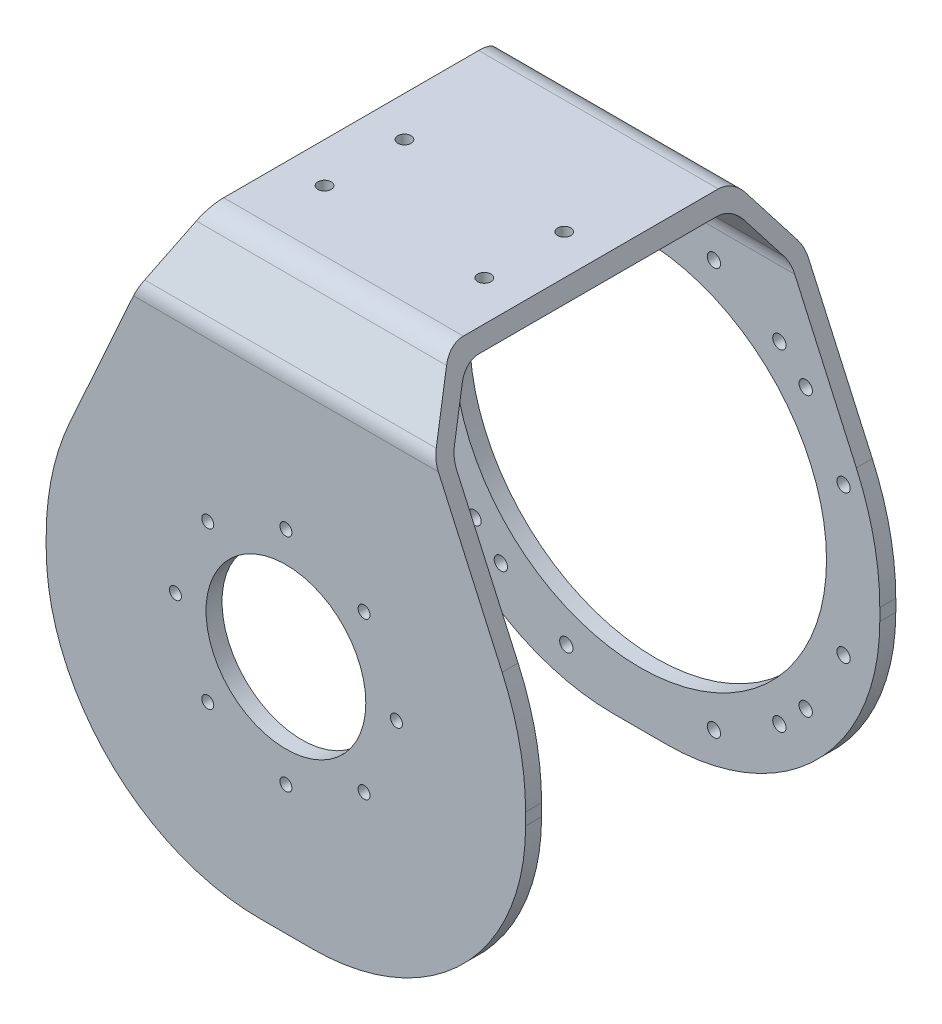
from build123d import *

# Parameters (mm, degrees)
EXTRUDE_1_DEPTH          = 180
CUT_EXTRUDE_1_DEPTH      = 283.252103624
CUT_EXTRUDE_1_DEPTH_BACK = 283.252103624
SKETCH_13_R              = 70
SKETCH_13_R_2            = 2.5
CUT_EXTRUDE_2_DEPTH      = 50
SKETCH_14_R              = 2.5
CUT_EXTRUDE_3_DEPTH      = 6
SKETCH_15_R              = 30
SKETCH_15_R_2            = 2.25
CUT_EXTRUDE_4_DEPTH      = 6
FILLET_1_R               = 100
FILLET_2_R               = 80
FILLET_3_R               = 10


with BuildPart() as part:
    # 草图11 → 拉伸-薄壁1 (new body)
    with BuildSketch(Plane(origin=(0, 0, 0), x_dir=(0, 0, -1), z_dir=(1, 0, 0))):
        Polygon((-63.5, 0), (-63.5, 180), (-50, 200), (50, 200), (63.5, 180), (63.5, 0), (69.5, 0), (69.5, 181.835492011), (53.188957107, 206), (-53.188957107, 206), (-69.5, 181.835492011), (-69.5, 0), align=None)
    extrude(amount=EXTRUDE_1_DEPTH)

    # 草图12 → 切除-拉伸1 (cut, two sides: drawn at the far end of the back side and taken through both)
    with BuildSketch(Plane.XY.offset(-CUT_EXTRUDE_1_DEPTH_BACK)):
        Polygon((45, 206), (0, 106), (0, 206), align=None)
        Polygon((180, 106), (180, 206), (135, 206), align=None)
    extrude(amount=CUT_EXTRUDE_1_DEPTH + CUT_EXTRUDE_1_DEPTH_BACK, mode=Mode.SUBTRACT)

    # 草图13 → 切除-拉伸2 (cut)
    with BuildSketch(Plane(origin=(0, 0, -69.5), x_dir=(-1, 0, 0), z_dir=(0, 0, -1))):
        with Locations(Location((-90, 90, 0), (0, 0, 90))):
            Circle(SKETCH_13_R)
        with Locations(Location((-117.709167863, 166.379084286, 0), (0, 0, 90))):
            Circle(SKETCH_13_R_2)
        with Locations(Location((-142.291643378, 152.18638543, 0), (0, 0, 90))):
            Circle(SKETCH_13_R_2)
        with Locations(Location((-152.18638543, 142.291643378, 0), (0, 0, 90))):
            Circle(SKETCH_13_R_2)
        with Locations(Location((-166.379084286, 117.709167863, 0), (0, 0, 90))):
            Circle(SKETCH_13_R_2)
        with Locations(Location((-13.620915714, 117.709167863, 0), (0, 0, 90))):
            Circle(SKETCH_13_R_2)
        with Locations(Location((-27.81361457, 142.291643378, 0), (0, 0, 90))):
            Circle(SKETCH_13_R_2)
        with Locations(Location((-37.708356622, 152.18638543, 0), (0, 0, 90))):
            Circle(SKETCH_13_R_2)
        with Locations(Location((-62.290832137, 166.379084286, 0), (0, 0, 90))):
            Circle(SKETCH_13_R_2)
        with Locations(Location((-62.290832137, 13.620915714, 0), (0, 0, 90))):
            Circle(SKETCH_13_R_2)
        with Locations(Location((-37.708356622, 27.81361457, 0), (0, 0, 90))):
            Circle(SKETCH_13_R_2)
        with Locations(Location((-27.81361457, 37.708356622, 0), (0, 0, 90))):
            Circle(SKETCH_13_R_2)
        with Locations(Location((-13.620915714, 62.290832137, 0), (0, 0, 90))):
            Circle(SKETCH_13_R_2)
        with Locations(Location((-166.379084286, 62.290832137, 0), (0, 0, 90))):
            Circle(SKETCH_13_R_2)
        with Locations(Location((-152.18638543, 37.708356622, 0), (0, 0, 90))):
            Circle(SKETCH_13_R_2)
        with Locations(Location((-142.291643378, 27.81361457, 0), (0, 0, 90))):
            Circle(SKETCH_13_R_2)
        with Locations(Location((-117.709167863, 13.620915714, 0), (0, 0, 90))):
            Circle(SKETCH_13_R_2)
    extrude(amount=-CUT_EXTRUDE_2_DEPTH, mode=Mode.SUBTRACT)

    # 草图14 → 切除-拉伸3 (cut)
    with BuildSketch(Plane(origin=(0, 206, 0), x_dir=(1, 0, 0), z_dir=(0, 1, 0))):
        with Locations(Location((120, 5, 0), (0, 0, 270))):
            Circle(SKETCH_14_R)
        with Locations(Location((120, -25, 0), (0, 0, 90))):
            Circle(SKETCH_14_R)
        with Locations(Location((60, -25, 0), (0, 0, 270))):
            Circle(SKETCH_14_R)
        with Locations(Location((60, 5, 0), (0, 0, 90))):
            Circle(SKETCH_14_R)
    extrude(amount=-CUT_EXTRUDE_3_DEPTH, mode=Mode.SUBTRACT)

    # 草图15 → 切除-拉伸4 (cut)
    with BuildSketch(Plane.XY.offset(69.5)):
        with Locations((90, 90)):
            Circle(SKETCH_15_R)
        with Locations((90, 131.5)):
            Circle(SKETCH_15_R_2)
        with Locations((119.344931419, 119.344931419)):
            Circle(SKETCH_15_R_2)
        with Locations((131.5, 90)):
            Circle(SKETCH_15_R_2)
        with Locations((119.344931419, 60.655068581)):
            Circle(SKETCH_15_R_2)
        with Locations((90, 48.5)):
            Circle(SKETCH_15_R_2)
        with Locations((60.655068581, 60.655068581)):
            Circle(SKETCH_15_R_2)
        with Locations((48.5, 90)):
            Circle(SKETCH_15_R_2)
        with Locations((60.655068581, 119.344931419)):
            Circle(SKETCH_15_R_2)
    extrude(amount=-CUT_EXTRUDE_4_DEPTH, mode=Mode.SUBTRACT)

    # 圆角1
    fillet_1_edges = [part.edges().sort_by_distance(p)[0] for p in [
        (0, 106, 66.5),
        (180, 106, 66.5),
        (0, 106, -66.5),
        (180, 106, -66.5),
    ]]
    fillet(fillet_1_edges, radius=FILLET_1_R)

    # 圆角2
    fillet_2_edges = [part.edges().sort_by_distance(p)[0] for p in [
        (0, 0, -66.5),
        (0, 0, 66.5),
        (180, 0, -66.5),
        (180, 0, 66.5),
    ]]
    fillet(fillet_2_edges, radius=FILLET_2_R)

    # 圆角3
    fillet_3_edges = [part.edges().sort_by_distance(p)[0] for p in [
        (90, 181.835492011, 69.5),
        (90, 206, 53.188957107),
        (90, 206, -53.188957107),
        (90, 181.835492011, -69.5),
        (90, 180, -63.5),
        (90, 200, -50),
        (90, 200, 50),
        (90, 180, 63.5),
    ]]
    fillet(fillet_3_edges, radius=FILLET_3_R)


solid = part.part
